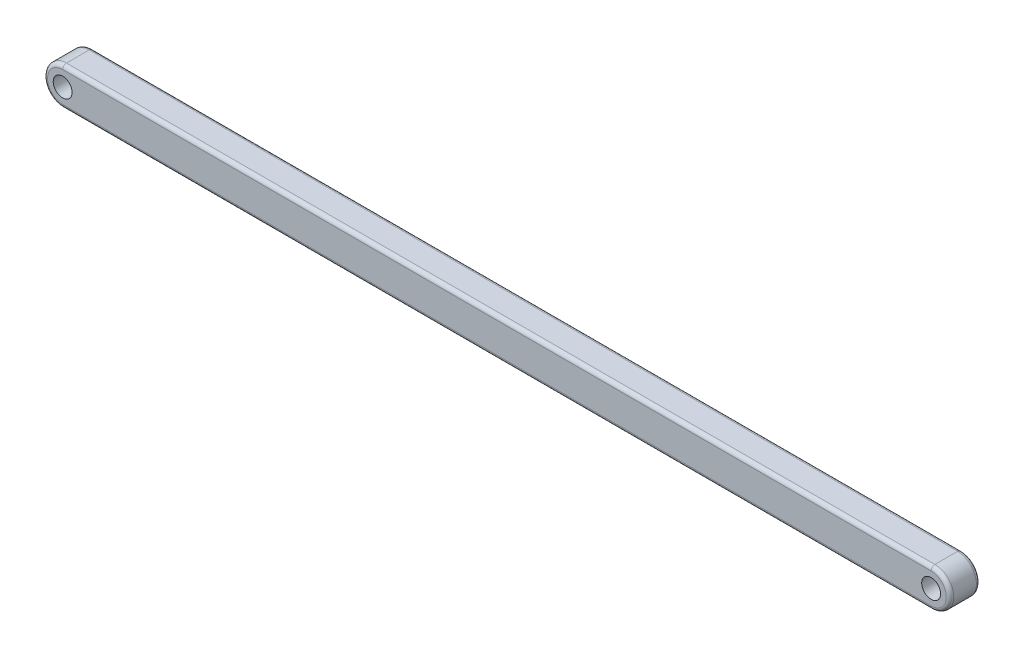
from build123d import *

# Parameters (mm, degrees)
SKETCH1_R           = 1.25
BOSS_EXTRUDE1_DEPTH = 4
FILLET1_R           = 0.5
SCALE_1_SCALE       = 2


with BuildPart() as part:
    # Sketch1 → Boss-Extrude1 (new body)
    with BuildSketch(Plane.XY):
        with BuildLine():
            Line((-46.206896552, 2.5), (68.793103448, 2.5))
            ThreePointArc((68.793103448, 2.5), (71.293103448, 0), (68.793103448, -2.5))
            Line((68.793103448, -2.5), (-46.206896552, -2.5))
            ThreePointArc((-46.206896552, -2.5), (-48.706896552, 0), (-46.206896552, 2.5))
        make_face()
        with Locations((-46.206896552, 0)):
            Circle(SKETCH1_R, mode=Mode.SUBTRACT)
        with Locations((68.793103448, 0)):
            Circle(SKETCH1_R, mode=Mode.SUBTRACT)
    extrude(amount=BOSS_EXTRUDE1_DEPTH)

    # Fillet1
    fillet1_edges = [part.edges().sort_by_distance(p)[0] for p in [
        (71.293103448, 0, 4),
        (11.293103448, 2.5, 4),
        (-48.706896552, 0, 4),
        (11.293103448, 2.5, 0),
        (71.293103448, 0, 0),
        (11.293103448, -2.5, 0),
        (-48.706896552, 0, 0),
        (11.293103448, -2.5, 4),
    ]]
    fillet(fillet1_edges, radius=FILLET1_R)


with BuildPart() as part_1:
    # 缩放比例1: scaled about (11.293103448, 0, 2)
    add(part.part.scale(SCALE_1_SCALE).moved(Location((-11.293103448, 0, -2))))


solid = part_1.part
